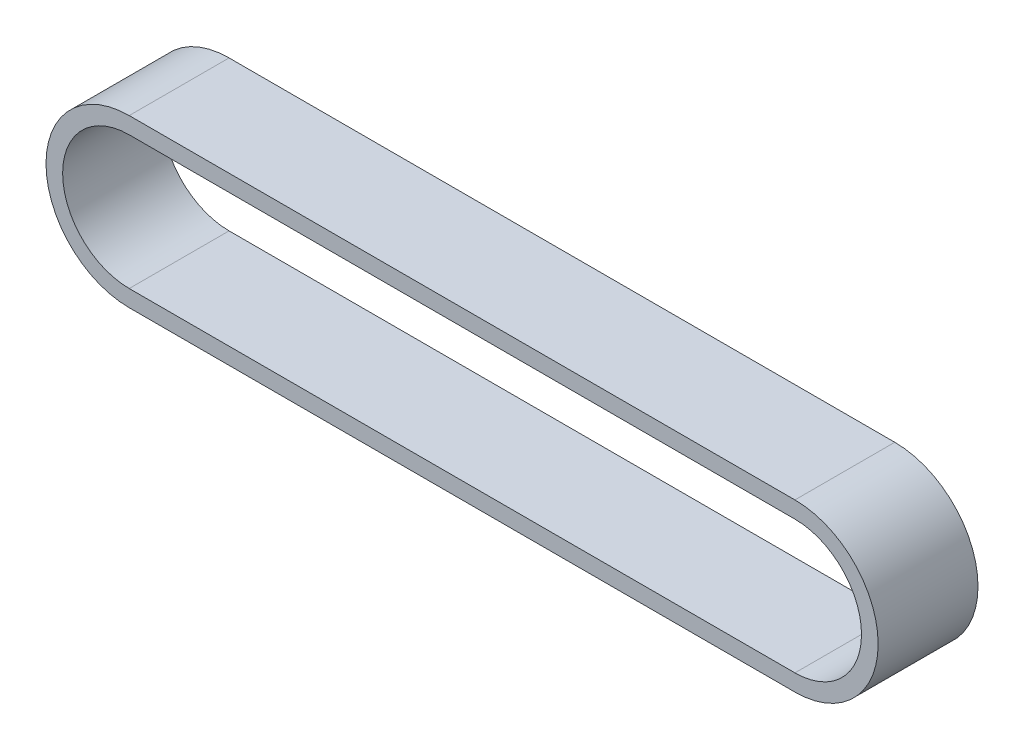
from build123d import *

# Parameters (mm, degrees)
BOSS_EXTRUDE1_DEPTH = 15.24


with BuildPart() as part:
    # Sketch1 → Boss-Extrude1 (new body)
    with BuildSketch(Plane.XY):
        with BuildLine():
            Line((0.588618423, 71.54034483), (102.188618423, 71.54034483))
            ThreePointArc((102.188618423, 71.54034483), (114.888618423, 58.84034483), (102.188618423, 46.14034483))
            Line((102.188618423, 46.14034483), (0.588618423, 46.14034483))
            ThreePointArc((0.588618423, 46.14034483), (-12.111381577, 58.84034483), (0.588618423, 71.54034483))
        make_face()
        with BuildLine():
            Line((0.588618423, 69.00034483), (102.188618423, 69.00034483))
            ThreePointArc((102.188618423, 69.00034483), (112.348618423, 58.84034483), (102.188618423, 48.68034483))
            Line((102.188618423, 48.68034483), (0.588618423, 48.68034483))
            ThreePointArc((0.588618423, 48.68034483), (-9.571381577, 58.84034483), (0.588618423, 69.00034483))
        make_face(mode=Mode.SUBTRACT)
    extrude(amount=BOSS_EXTRUDE1_DEPTH)


solid = part.part
